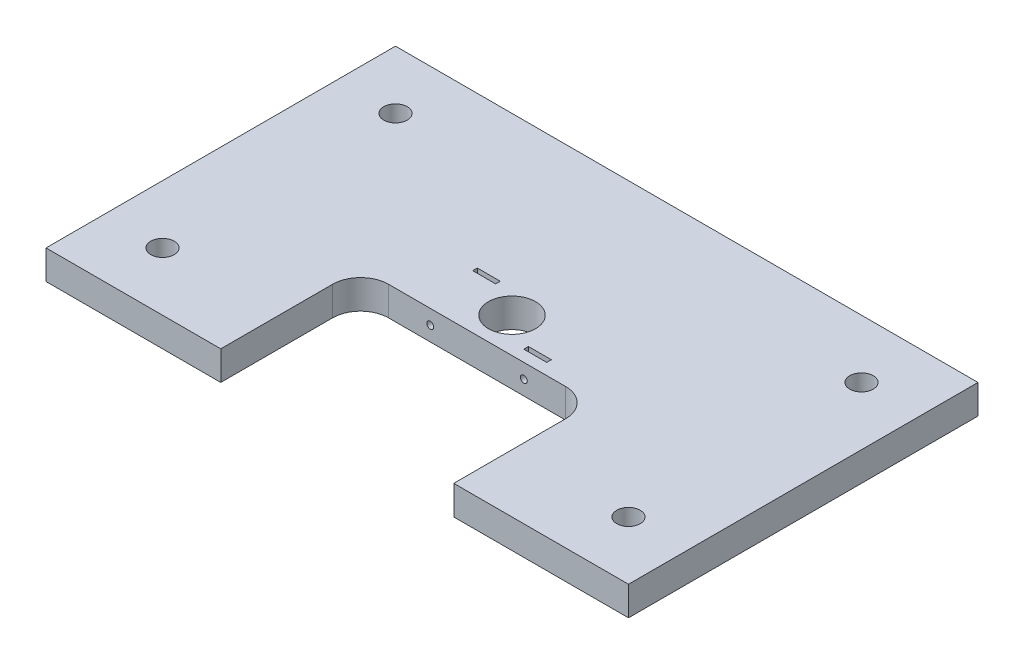
from build123d import *

# Parameters (mm, degrees)
SKETCH1_W               = 127
SKETCH1_H               = 76.2
BOSS_EXTRUDE1_DEPTH     = 6.35
SKETCH3_R               = 5.125
SKETCH3_W               = 50.8
SKETCH3_H               = 30.48
SKETCH3_W_2             = 5
SKETCH3_H_2             = 1
CUT_EXTRUDE1_DEPTH      = 75.324844433
FILLET1_R               = 6.096
SKETCH4_R               = 0.75
CUT_EXTRUDE2_DEPTH      = 19.05
F_1_4_20_TAPPED_HOLE1_D = 5.1054


with BuildPart() as part:
    # Sketch1 → Boss-Extrude1 (new body)
    with BuildSketch(Plane(origin=(0, 0, 0), x_dir=(1, 0, 0), z_dir=(0, 1, 0))):
        Rectangle(SKETCH1_W, SKETCH1_H)
    extrude(amount=BOSS_EXTRUDE1_DEPTH)

    # Sketch3 → Cut-Extrude1 (cut, through all)
    with BuildSketch(Plane(origin=(0, 6.35, 0), x_dir=(1, 0, 0), z_dir=(0, 1, 0))):
        with Locations(Location((0, 0, 0), (0, 0, 270))):
            Circle(SKETCH3_R)
        with Locations((0, -22.86)):
            Rectangle(SKETCH3_W, SKETCH3_H)
        with Locations((10.2, -4.625)):
            Rectangle(SKETCH3_W_2, SKETCH3_H_2)
        with Locations((-10.2, 4.625)):
            Rectangle(SKETCH3_W_2, SKETCH3_H_2)
    extrude(amount=-CUT_EXTRUDE1_DEPTH, mode=Mode.SUBTRACT)

    # Fillet1
    fillet1_edges = [part.edges().sort_by_distance(p)[0] for p in [
        (-25.4, 3.175, 7.62),
        (25.4, 3.175, 7.62),
    ]]
    fillet(fillet1_edges, radius=FILLET1_R)

    # Sketch4 → Cut-Extrude2 (cut)
    with BuildSketch(Plane.XY.offset(7.62)):
        with Locations((-10.2, 3.175)):
            Circle(SKETCH4_R)
        with Locations((10.2, 3.175)):
            Circle(SKETCH4_R)
    extrude(amount=-CUT_EXTRUDE2_DEPTH, mode=Mode.SUBTRACT)

    # 1/4-20 Tapped Hole1 (through all)
    with Locations(Plane(origin=(0, 6.35, 0), x_dir=(1, 0, 0), z_dir=(0, 1, 0))):
        with Locations((-50.8, 25.4), (50.8, 25.4), (50.8, -25.4), (-50.8, -25.4)):
            Hole(F_1_4_20_TAPPED_HOLE1_D / 2)


solid = part.part
